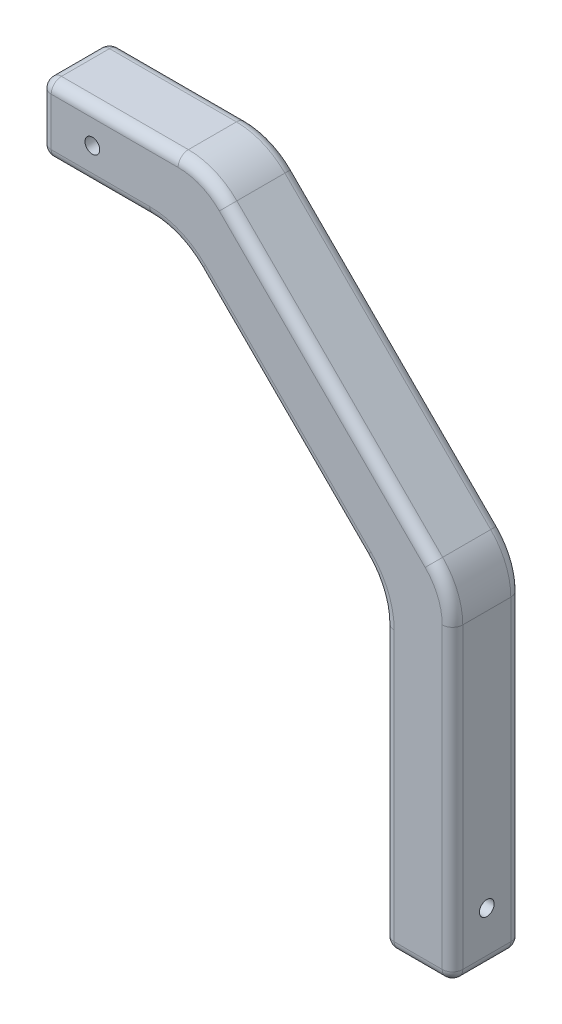
from build123d import *

# Parameters (mm, degrees)
CROQUIS1_R              = 2.15
SALIENTE_EXTRUIR1_DEPTH = 20
REDONDEO1_R             = 20
CROQUIS4_R              = 2.15
CORTAR_EXTRUIR3_DEPTH   = 20
REDONDEO2_R             = 3


with BuildPart() as part:
    # Croquis1 → Saliente-Extruir1 (new body)
    with BuildSketch(Plane.XY):
        Polygon((-60, 0), (-11.715728753, 0), (60, -71.715728753), (60, -170), (40, -170), (40, -80), (-20, -20), (-60, -20), align=None)
        with Locations((-45, -10)):
            Circle(CROQUIS1_R, mode=Mode.SUBTRACT)
    extrude(amount=SALIENTE_EXTRUIR1_DEPTH)

    # Redondeo1
    redondeo1_edges = [part.edges().sort_by_distance(p)[0] for p in [
        (-20, -20, 10),
        (40, -80, 10),
        (60, -71.715728753, 10),
        (-11.715728753, 0, 10),
    ]]
    fillet(redondeo1_edges, radius=REDONDEO1_R)

    # Croquis4 → Cortar-Extruir3 (cut)
    with BuildSketch(Plane.ZY.offset(-40)):
        with Locations(Location((10, -155, 0), (0, 0, 270))):
            Circle(CROQUIS4_R)
    extrude(amount=-CORTAR_EXTRUIR3_DEPTH, mode=Mode.SUBTRACT)

    # Redondeo2
    redondeo2_edges = [part.edges().sort_by_distance(p)[0] for p in [
        (-40, 0, 0),
        (-60, -10, 0),
        (-60, -20, 10),
        (40, -170, 10),
        (60, -170, 10),
        (-60, 0, 10),
        (50, -170, 20),
        (40, -129.142135624, 20),
        (10, -50, 0),
        (10, -50, 20),
        (24.142135624, -35.857864376, 0),
        (24.142135624, -35.857864376, 20),
        (60, -125, 0),
        (-44.142135624, -20, 0),
        (-12.346331353, -1.52240935, 0),
        (58.47759065, -72.346331353, 0),
        (60, -125, 20),
        (-44.142135624, -20, 20),
        (-12.346331353, -1.52240935, 20),
        (58.47759065, -72.346331353, 20),
        (38.47759065, -80.6306026, 0),
        (38.47759065, -80.6306026, 20),
        (-20.6306026, -21.52240935, 0),
        (-20.6306026, -21.52240935, 20),
        (-60, -10, 20),
        (-40, 0, 20),
        (40, -129.142135624, 0),
        (50, -170, 0),
    ]]
    fillet(redondeo2_edges, radius=REDONDEO2_R)


solid = part.part
